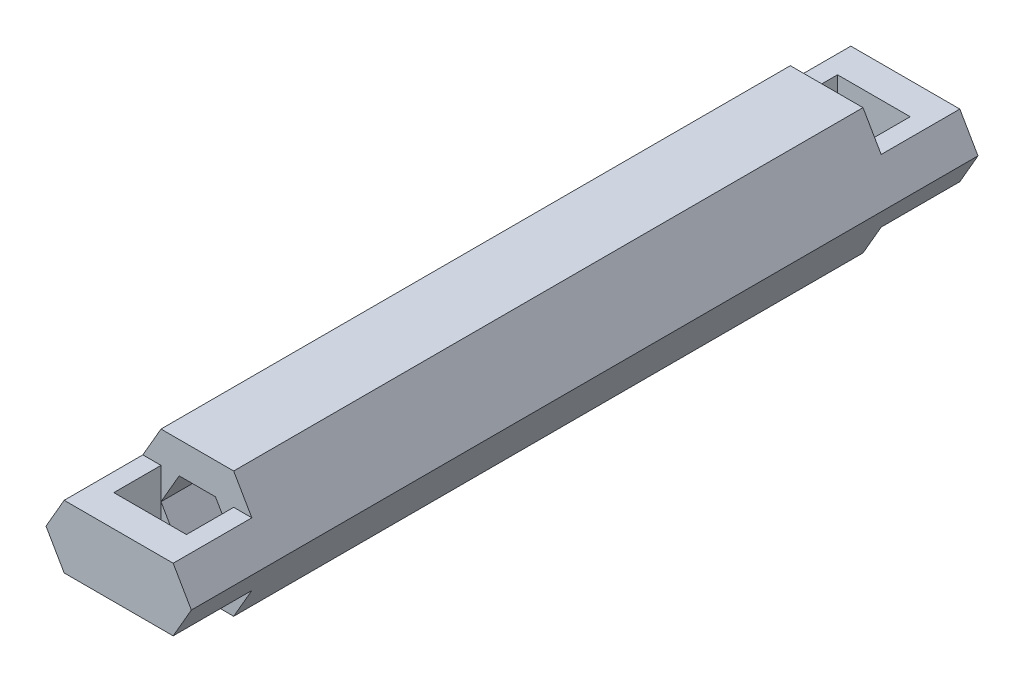
from build123d import *

# Parameters (mm, degrees)
BOSS_EXTRUDE1_DEPTH = 100
BOSS_EXTRUDE2_DEPTH = 12.5
BOSS_EXTRUDE3_REACH = 116.264
SKETCH7_W           = 5
SKETCH7_H           = 10


with BuildPart() as part:
    # Sketch3 → Boss-Extrude1 (new body)
    with BuildSketch(Plane.XY):
        Polygon((11.547005384, 0), (5.773502692, 10), (-5.773502692, 10), (-11.547005384, 0), (-5.773502692, -10), (5.773502692, -10), align=None)
        Polygon((5.773502692, 0), (2.886751346, 5), (-2.886751346, 5), (-5.773502692, 0), (-2.886751346, -5), (2.886751346, -5), align=None, mode=Mode.SUBTRACT)
    extrude(amount=BOSS_EXTRUDE1_DEPTH)

    # Sketch5 → Boss-Extrude2 (add)
    with BuildSketch(Plane.XY.offset(100)):
        Polygon((5.773502692, 5), (8.660254038, 5), (11.547005384, 0), (8.660254038, -5), (5.773502692, -5), align=None)
        Polygon((-8.660254038, 5), (-11.547005384, 0), (-8.660254038, -5), (-5.773502692, -5), (-5.773502692, 5), align=None)
    boss_extrude2 = extrude(amount=BOSS_EXTRUDE2_DEPTH)

    # Sketch7 → Boss-Extrude3 (add, up to next)
    with BuildSketch(Plane(origin=(-5.773502692, 0, 0), x_dir=(0, 0, -1), z_dir=(1, 0, 0)), mode=Mode.PRIVATE) as boss_extrude3_sk1:
        with Locations((-110, 0)):
            Rectangle(SKETCH7_W, SKETCH7_H)
    boss_extrude3_tool1 = extrude(boss_extrude3_sk1.sketch, amount=BOSS_EXTRUDE3_REACH, mode=Mode.PRIVATE) - part.part
    boss_extrude3 = boss_extrude3_tool1.solids().sort_by_distance((-5.773503, 0, 110))[0]
    add(boss_extrude3)

    # Mirror1: Boss-Extrude2, Boss-Extrude3 across plane
    add(boss_extrude2.mirror(Plane.XY.offset(50)))
    add(boss_extrude3.mirror(Plane.XY.offset(50)))


solid = part.part
